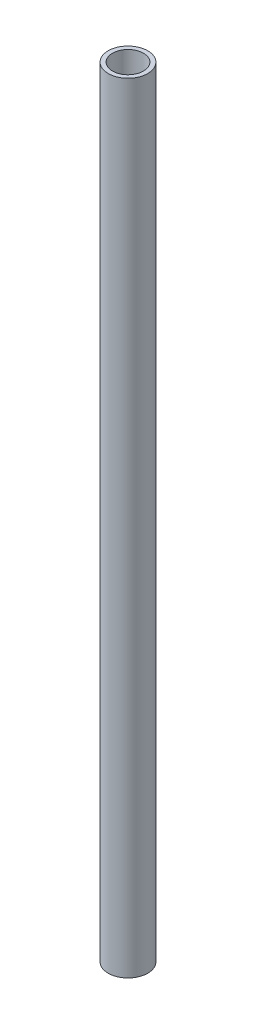
from build123d import *

# Parameters (mm, degrees)
SKETCH12_R                         = 10.65
SKETCH12_R_2                       = 8.35
PIPE_CONFIGURED_21_3_X_2_3_1_DEPTH = 420


with BuildPart() as part:
    # Sketch12 → Pipe - configured 21.3 X 2.3(1) (new body)
    with BuildSketch(Plane(origin=(0, 0, 0), x_dir=(-1, 0, 0), z_dir=(0, 1, 0))):
        Circle(SKETCH12_R)
        Circle(SKETCH12_R_2, mode=Mode.SUBTRACT)
    extrude(amount=PIPE_CONFIGURED_21_3_X_2_3_1_DEPTH)


solid = part.part
